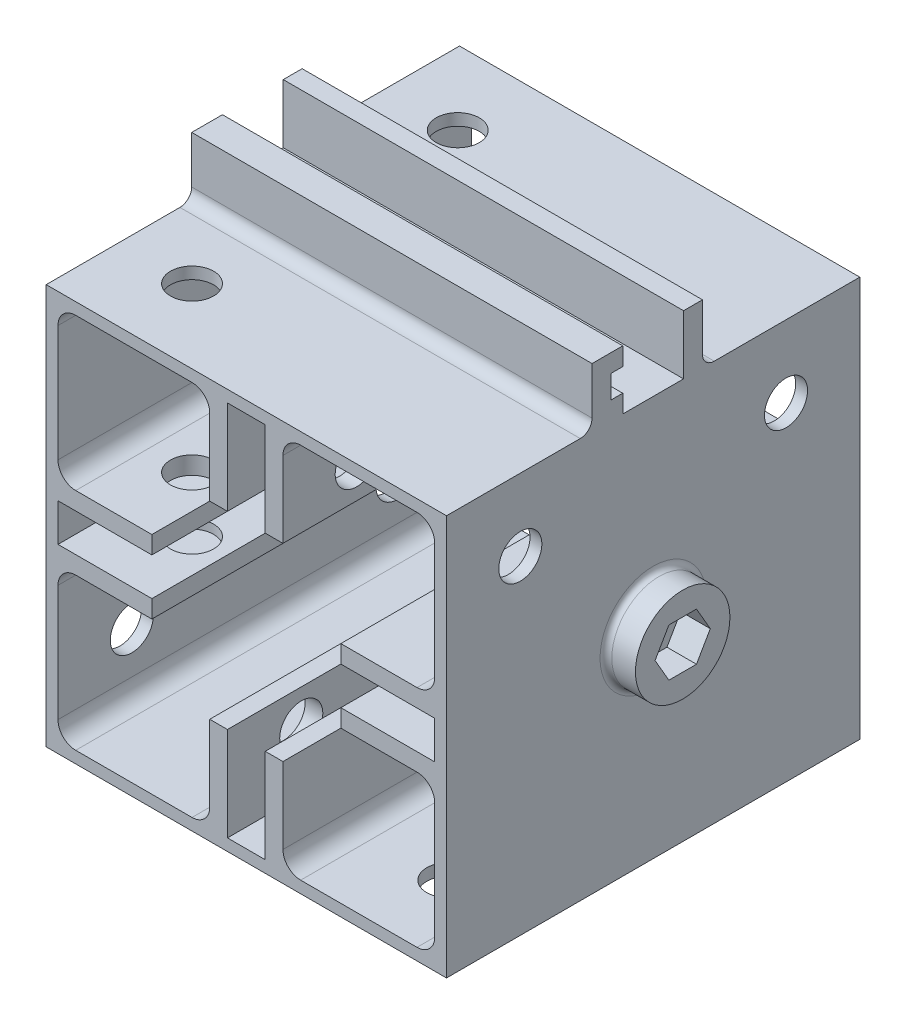
from build123d import *

# Parameters (mm, degrees)
SKETCH2_W           = 67.8
SKETCH2_H           = 67.8
BOSS_EXTRUDE1_DEPTH = 35
FILLET1_R           = 3
SKETCH3_R           = 3.65
CUT_EXTRUDE1_DEPTH  = 38.6
SKETCH4_R           = 3.65
CUT_EXTRUDE2_DEPTH  = 38.6
SKETCH5_R           = 3.65
CUT_EXTRUDE3_DEPTH  = 38.6
SKETCH6_R           = 3.65
CUT_EXTRUDE4_DEPTH  = 38.6
SKETCH7_R           = 8
BOSS_EXTRUDE2_DEPTH = 5
SKETCH8_R           = 2.675
CUT_EXTRUDE5_DEPTH  = 17.9
FILLET2_R           = 1
BOSS_EXTRUDE3_DEPTH = 67.8
FILLET3_R           = 2


with BuildPart() as part:
    # Sketch2 → Boss-Extrude1 (new, symmetric)
    with BuildSketch(Plane.XY):
        Rectangle(SKETCH2_W, SKETCH2_H)
        Polygon((3.2, 16), (6.2, 16), (6.2, 31.9), (31.9, 31.9), (31.9, 6.2), (16, 6.2), (16, 3.2), (31.9, 3.2), (31.9, -3.2), (16, -3.2), (16, -6.2), (31.9, -6.2), (31.9, -31.9), (6.2, -31.9), (6.2, -16), (3.2, -16), (3.2, -31.9), (-3.2, -31.9), (-3.2, -16), (-6.2, -16), (-6.2, -31.9), (-31.9, -31.9), (-31.9, -6.2), (-16, -6.2), (-16, -3.2), (-31.9, -3.2), (-31.9, 3.2), (-16, 3.2), (-16, 6.2), (-31.9, 6.2), (-31.9, 31.9), (-6.2, 31.9), (-6.2, 16), (-3.2, 16), (-3.2, 31.9), (3.2, 31.9), align=None, mode=Mode.SUBTRACT)
    extrude(amount=BOSS_EXTRUDE1_DEPTH, both=True)

    # Fillet1
    fillet1_edges = [part.edges().sort_by_distance(p)[0] for p in [
        (-31.9, -6.2, 0),
        (-31.9, -31.9, 0),
        (-6.2, -31.9, 0),
        (6.2, -31.9, 0),
        (31.9, -31.9, 0),
        (31.9, -6.2, 0),
        (31.9, 6.2, 0),
        (31.9, 31.9, 0),
        (6.2, 31.9, 0),
        (-6.2, 31.9, 0),
        (-31.9, 31.9, 0),
        (-31.9, 6.2, 0),
    ]]
    fillet(fillet1_edges, radius=FILLET1_R)

    # Sketch3 → Cut-Extrude1 (cut)
    with BuildSketch(Plane(origin=(0, 33.9, 0), x_dir=(1, 0, 0), z_dir=(0, 1, 0))):
        with Locations(Location((-21.7, -22.5, 0), (0, 0, 270))):
            Circle(SKETCH3_R)
        with Locations(Location((-21.7, 22.5, 0), (0, 0, 270))):
            Circle(SKETCH3_R)
    extrude(amount=-CUT_EXTRUDE1_DEPTH, mode=Mode.SUBTRACT)

    # Sketch4 → Cut-Extrude2 (cut)
    with BuildSketch(Plane(origin=(33.9, 0, 0), x_dir=(0, 0, -1), z_dir=(1, 0, 0))):
        with Locations((22.5, 21.7)):
            Circle(SKETCH4_R)
        with Locations((-22.5, 21.7)):
            Circle(SKETCH4_R)
    extrude(amount=-CUT_EXTRUDE2_DEPTH, mode=Mode.SUBTRACT)

    # Sketch5 → Cut-Extrude3 (cut)
    with BuildSketch(Plane.XZ.offset(33.9)):
        with Locations((21.7, -22.5)):
            Circle(SKETCH5_R)
        with Locations((21.7, 22.5)):
            Circle(SKETCH5_R)
    extrude(amount=-CUT_EXTRUDE3_DEPTH, mode=Mode.SUBTRACT)

    # Sketch6 → Cut-Extrude4 (cut)
    with BuildSketch(Plane.ZY.offset(33.9)):
        with Locations(Location((-22.5, -21.7, 0), (0, 0, 270))):
            Circle(SKETCH6_R)
        with Locations(Location((22.5, -21.7, 0), (0, 0, 270))):
            Circle(SKETCH6_R)
    extrude(amount=-CUT_EXTRUDE4_DEPTH, mode=Mode.SUBTRACT)

    # Sketch7 → Boss-Extrude2 (add)
    with BuildSketch(Plane(origin=(33.9, 0, 0), x_dir=(0, 0, -1), z_dir=(1, 0, 0))):
        with Locations(Location((0, 0, 0), (0, 0, 180))):
            Circle(SKETCH7_R)
        Polygon((2.3375, 4.048668763), (-2.3375, 4.048668763), (-4.675, 0), (-2.3375, -4.048668763), (2.3375, -4.048668763), (4.675, 0), align=None, mode=Mode.SUBTRACT)
    extrude(amount=BOSS_EXTRUDE2_DEPTH)

    # Sketch8 → Cut-Extrude5 (cut)
    with BuildSketch(Plane(origin=(33.9, 0, 0), x_dir=(0, 0, -1), z_dir=(1, 0, 0))):
        Circle(SKETCH8_R)
    extrude(amount=-CUT_EXTRUDE5_DEPTH, mode=Mode.SUBTRACT)

    # Fillet2
    fillet2_edges = [part.edges().sort_by_distance(p)[0] for p in [
        (33.9, 0, -8),
    ]]
    fillet(fillet2_edges, radius=FILLET2_R)

    # Sketch9 → Boss-Extrude3 (add)
    with BuildSketch(Plane(origin=(33.9, 0, 0), x_dir=(0, 0, -1), z_dir=(1, 0, 0))):
        Polygon((5.15, 33.9), (5.15, 43.9), (8.35, 43.9), (8.35, 31.9), (-8.35, 31.9), (-8.35, 33.9), (-10.35, 33.9), (-10.35, 43.9), (-5.15, 43.9), (-5.15, 40.85), (-7.15, 40.85), (-7.15, 36.95), (-5.15, 36.95), (-5.15, 33.9), align=None)
    extrude(amount=-BOSS_EXTRUDE3_DEPTH)

    # Fillet3
    fillet3_edges = [part.edges().sort_by_distance(p)[0] for p in [
        (0, 33.9, -8.35),
        (0, 33.9, 10.35),
    ]]
    fillet(fillet3_edges, radius=FILLET3_R)


solid = part.part
